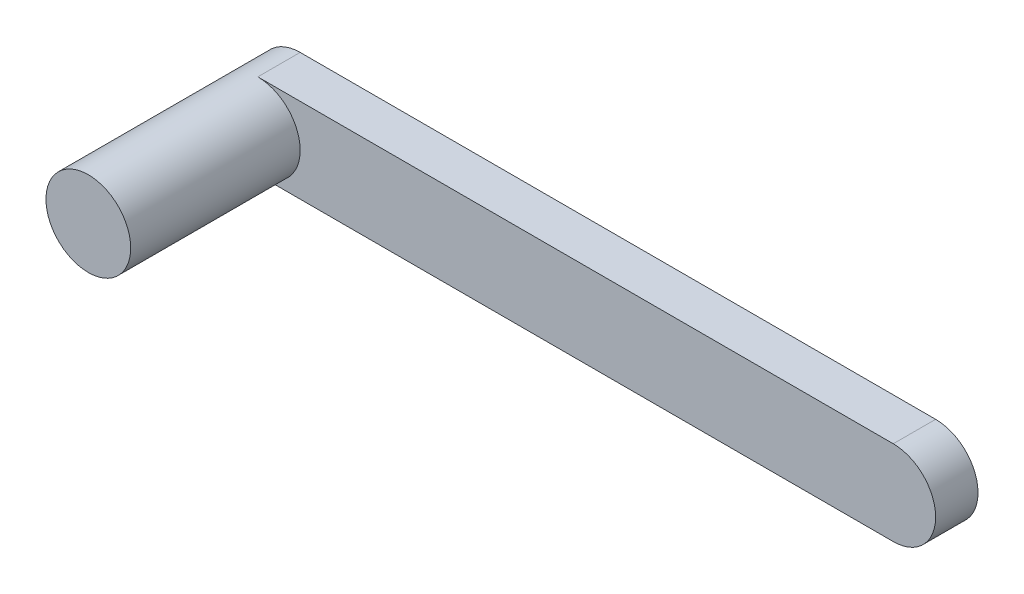
from build123d import *

# Parameters (mm, degrees)
BOSS_EXTRUDE1_DEPTH = 2
SKETCH2_R           = 2
BOSS_EXTRUDE2_DEPTH = 8


with BuildPart() as part:
    # Sketch1 → Boss-Extrude1 (new body)
    with BuildSketch(Plane.XY):
        with BuildLine():
            Line((0, -2), (30, -2))
            ThreePointArc((30, -2), (32, 0), (30, 2))
            Line((30, 2), (0, 2))
            ThreePointArc((0, 2), (-2, 0), (0, -2))
        make_face()
    extrude(amount=BOSS_EXTRUDE1_DEPTH)

    # Sketch2 → Boss-Extrude2 (add)
    with BuildSketch(Plane.XY.offset(2)):
        with Locations(Location((0, 0, 0), (0, 0, 270))):
            Circle(SKETCH2_R)
    extrude(amount=BOSS_EXTRUDE2_DEPTH)


solid = part.part
